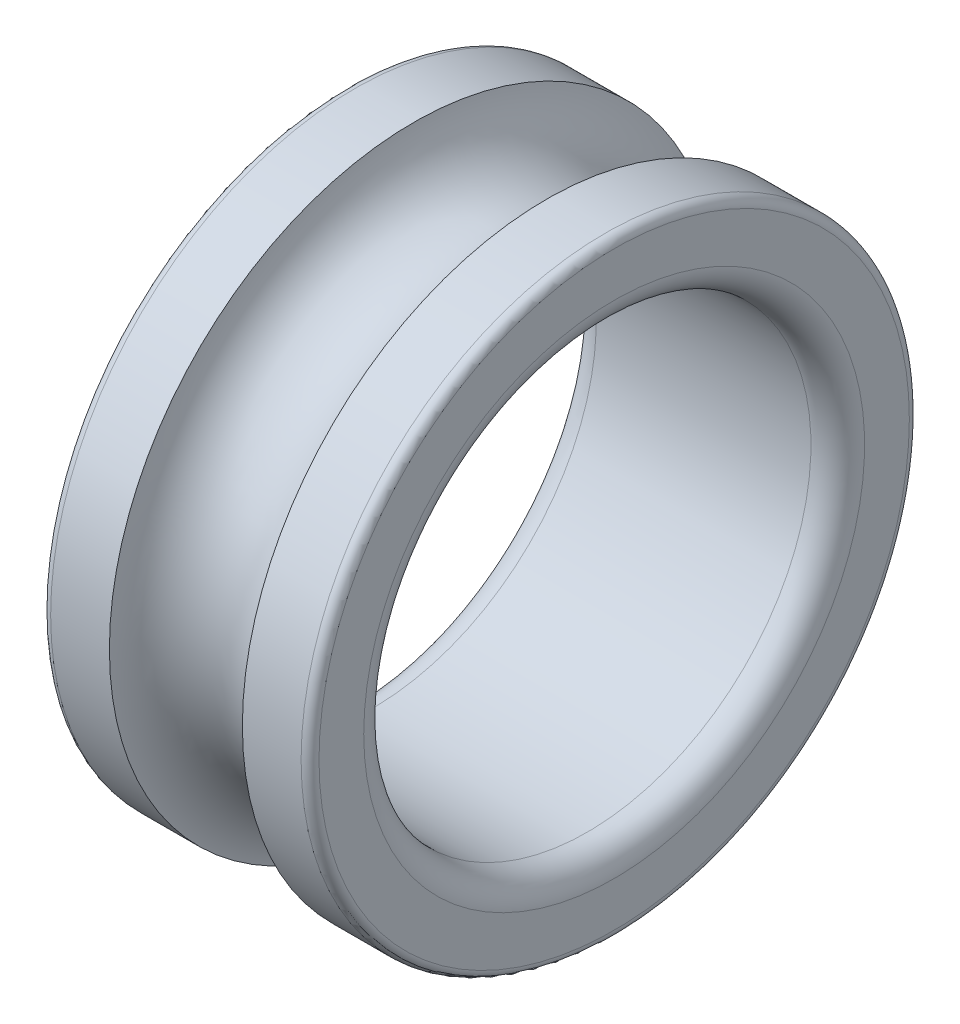
from build123d import *


with BuildPart() as part:
    # Sketch1 → Revolve1 (revolve)
    with BuildSketch(Plane(origin=(0, 0, 0), x_dir=(-1, 0, 0), z_dir=(0, 0, -1)), mode=Mode.PRIVATE) as revolve1_sk:
        with BuildLine():
            Line((-2.35, 3.4), (-3.006696563, 3.4))
            ThreePointArc((-3.006696563, 3.4), (-3.75, 2.75), (-4.493303437, 3.4))
            Line((-4.493303437, 3.4), (-5.15, 3.4))
            ThreePointArc((-5.15, 3.4), (-5.220710678, 3.370710678), (-5.25, 3.3))
            Line((-5.25, 3.3), (-5.25, 2.8))
            ThreePointArc((-5.25, 2.8), (-5.162132034, 2.587867966), (-4.95, 2.5))
            Line((-4.95, 2.5), (-2.55, 2.5))
            ThreePointArc((-2.55, 2.5), (-2.337867966, 2.587867966), (-2.25, 2.8))
            Line((-2.25, 2.8), (-2.25, 3.3))
            ThreePointArc((-2.25, 3.3), (-2.279289322, 3.370710678), (-2.35, 3.4))
        make_face()
    revolve(revolve1_sk.sketch.rotate(Axis((7.001253994, 0, 0), (-1, 0, 0)), 270), axis=Axis((7.001253994, 0, 0), (-1, 0, 0)))


solid = part.part
